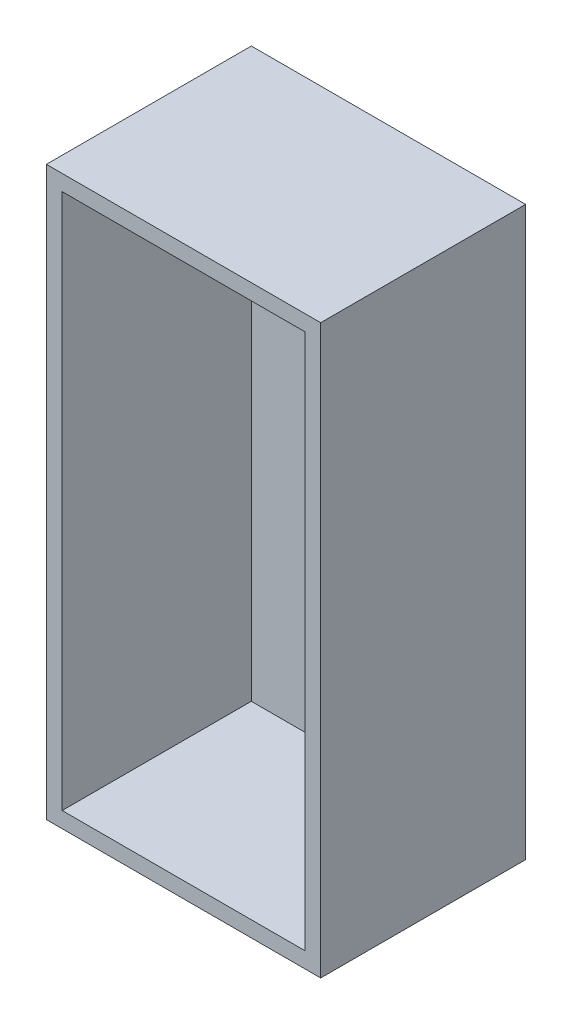
from build123d import *

# Parameters (mm, degrees)
SKETCH1_W           = 87
SKETCH1_H           = 65
BOSS_EXTRUDE1_DEPTH = 90
SHELL1_T            = -5


with BuildPart() as part:
    # Sketch1 → Boss-Extrude1 (new, symmetric)
    with BuildSketch(Plane(origin=(0, 0, 0), x_dir=(-1, 0, 0), z_dir=(0, 1, 0))):
        Rectangle(SKETCH1_W, SKETCH1_H)
    extrude(amount=BOSS_EXTRUDE1_DEPTH, both=True)

    # Shell1
    shell1_openings = [part.faces().sort_by_distance(p)[0] for p in [
        (0, 0, 32.5),
    ]]
    offset(amount=SHELL1_T, openings=shell1_openings, kind=Kind.INTERSECTION)


solid = part.part
